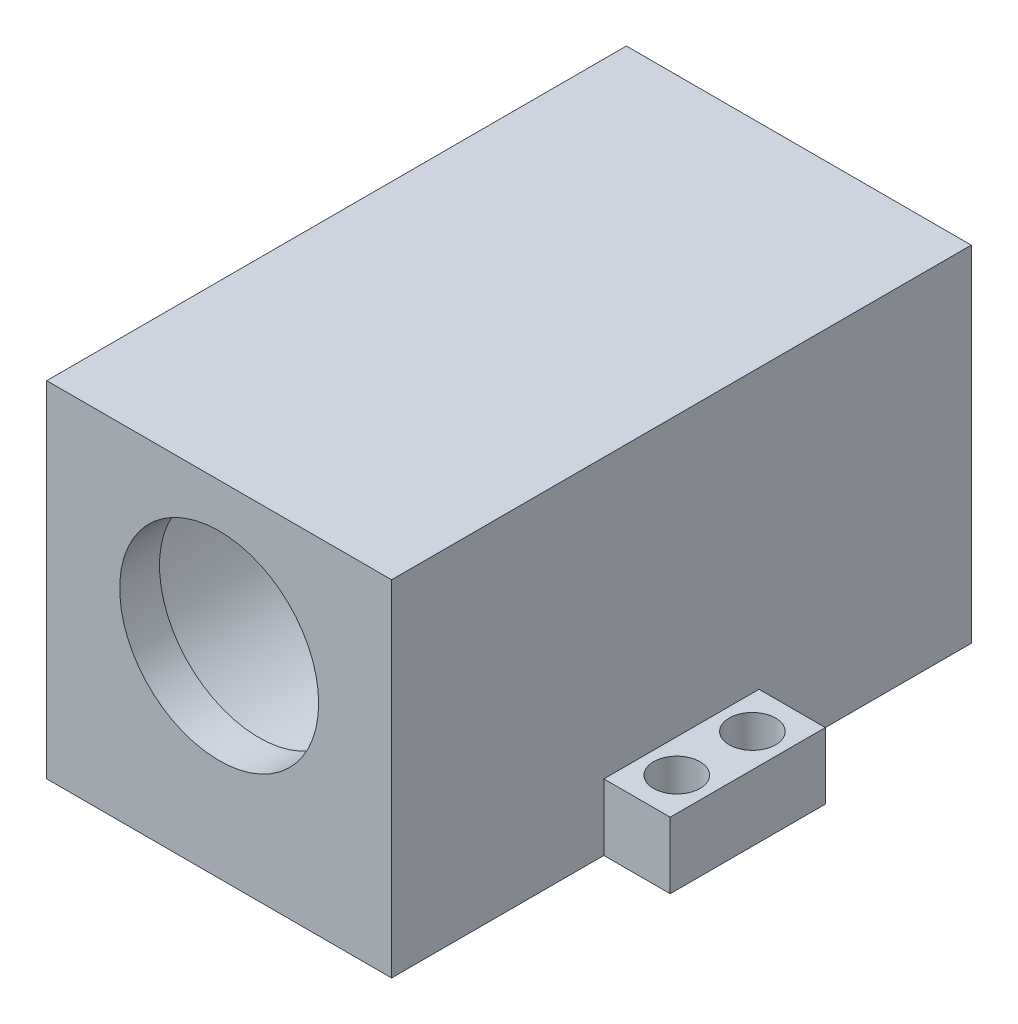
from build123d import *

# Parameters (mm, degrees)
ESQUISSE1_W             = 26
ESQUISSE1_H             = 26
ESQUISSE1_R             = 10.6
BOSS_EXTRU_1_DEPTH      = 40.7
ESQUISSE7_W             = 26
ESQUISSE7_H             = 26
ESQUISSE7_R             = 7.5
BOSS_EXTRU_5_DEPTH      = 3
ESQUISSE9_W             = 11.7
ESQUISSE9_H             = 5
BOSS_EXTRU_6_DEPTH      = 5
ESQUISSE11_R            = 1.75
ENL_V_MAT_EXTRU_1_DEPTH = 52.717405194
ESQUISSE17_W            = 11.7
ESQUISSE17_H            = 5
BOSS_EXTRU_7_DEPTH      = 5
ESQUISSE18_R            = 1.75
ENL_V_MAT_EXTRU_2_DEPTH = 52.717405194


with BuildPart() as part:
    # Esquisse1 → Boss.-Extru.1 (new body)
    with BuildSketch(Plane.XY):
        with Locations((0, -2.19)):
            Rectangle(ESQUISSE1_W, ESQUISSE1_H)
        Circle(ESQUISSE1_R, mode=Mode.SUBTRACT)
    extrude(amount=BOSS_EXTRU_1_DEPTH)

    # Esquisse7 → Boss.-Extru.5 (add)
    with BuildSketch(Plane.XY.offset(40.7)):
        with Locations((0, -2.19)):
            Rectangle(ESQUISSE7_W, ESQUISSE7_H)
        Circle(ESQUISSE7_R, mode=Mode.SUBTRACT)
    extrude(amount=BOSS_EXTRU_5_DEPTH)

    # Esquisse9 → Boss.-Extru.6 (add)
    with BuildSketch(Plane.ZY.offset(13)):
        with Locations((21.85, -12.69)):
            Rectangle(ESQUISSE9_W, ESQUISSE9_H)
    extrude(amount=BOSS_EXTRU_6_DEPTH)

    # Esquisse11 → Enlèv. mat.-Extru.1 (cut, through all)
    with BuildSketch(Plane(origin=(0, -10.19, 0), x_dir=(1, 0, 0), z_dir=(0, 1, 0))):
        with Locations((-15.450046311, -19)):
            Circle(ESQUISSE11_R)
        with Locations((-15.450046311, -24.7)):
            Circle(ESQUISSE11_R)
    extrude(amount=-ENL_V_MAT_EXTRU_1_DEPTH, mode=Mode.SUBTRACT)

    # Esquisse17 → Boss.-Extru.7 (add)
    with BuildSketch(Plane(origin=(13, 0, 0), x_dir=(0, 0, -1), z_dir=(1, 0, 0))):
        with Locations((-21.85, -12.69)):
            Rectangle(ESQUISSE17_W, ESQUISSE17_H)
    extrude(amount=BOSS_EXTRU_7_DEPTH)

    # Esquisse18 → Enlèv. mat.-Extru.2 (cut, through all)
    with BuildSketch(Plane(origin=(0, -10.19, 0), x_dir=(1, 0, 0), z_dir=(0, 1, 0))):
        with Locations((15.5, -24.7)):
            Circle(ESQUISSE18_R)
        with Locations((15.5, -19)):
            Circle(ESQUISSE18_R)
    extrude(amount=-ENL_V_MAT_EXTRU_2_DEPTH, mode=Mode.SUBTRACT)


solid = part.part
